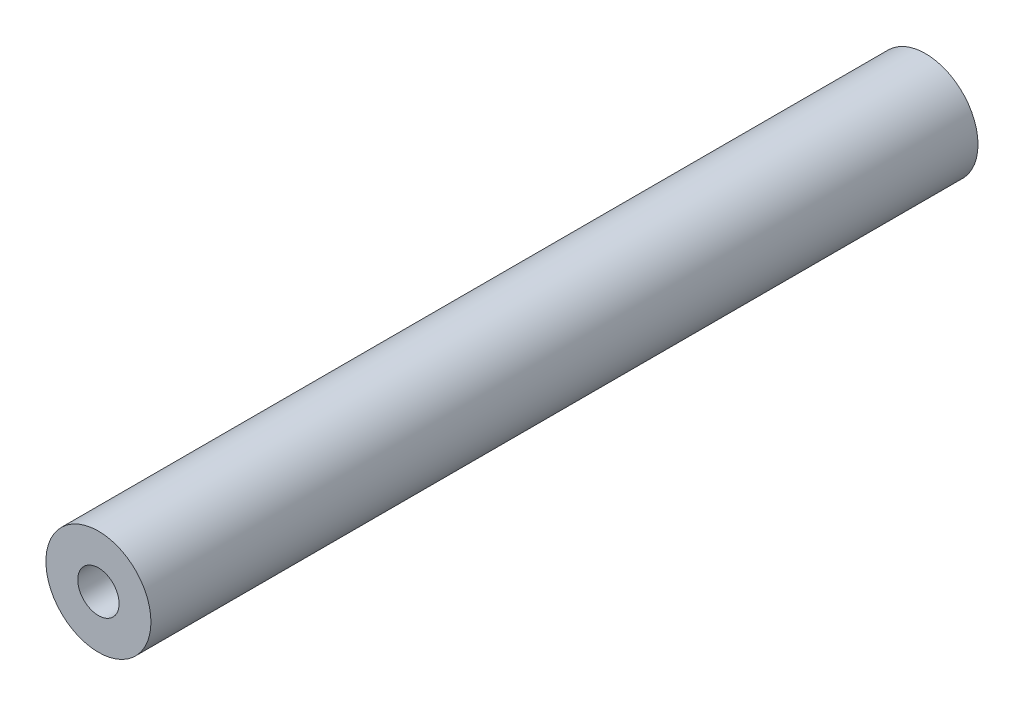
from build123d import *

# Parameters (mm, degrees)
CROQUIS1_R              = 6.35
SALIENTE_EXTRUIR1_DEPTH = 50


with BuildPart() as part:
    # Croquis1 → Saliente-Extruir1 (new, symmetric)
    with BuildSketch(Plane.XY):
        Circle(CROQUIS1_R)
    extrude(amount=SALIENTE_EXTRUIR1_DEPTH, both=True)

    # Croquis3 → Taladro roscado M61 (revolve, cut)
    with BuildSketch(Plane(origin=(0, 0, 50), x_dir=(0, -1, 0), z_dir=(1, 0, 0))):
        Polygon((0, 0), (0, 18.502151548), (2.5, 17), (2.5, 0), align=None)
    taladro_roscado_m61 = revolve(axis=Axis((0, 0, 56.35), (0, 0, -1)), mode=Mode.SUBTRACT)

    # Simetría1: Taladro roscado M61 across plane
    add(taladro_roscado_m61.mirror(Plane.XY), mode=Mode.SUBTRACT)


solid = part.part
